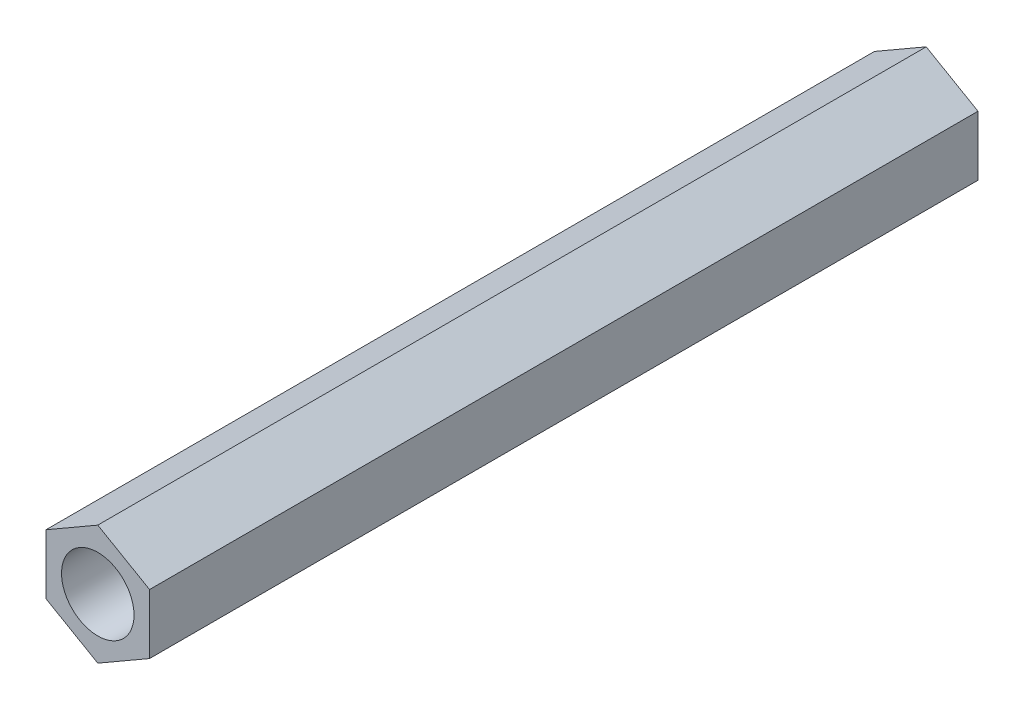
from build123d import *

# Parameters (mm, degrees)
EXTRUDE_1_DEPTH          = 40
CUT_EXTRUDE_1_DEPTH      = 41.181878171
CUT_EXTRUDE_1_DEPTH_BACK = 41.181878171
SKETCH_2_R               = 1.75


with BuildPart() as part:
    # 草圖1 → 填料-伸長1 (new body)
    with BuildSketch(Plane.XY):
        Polygon((0, -2.886751346), (2.5, -1.443375673), (2.5, 1.443375673), (0, 2.886751346), (-2.5, 1.443375673), (-2.5, -1.443375673), align=None)
    extrude(amount=EXTRUDE_1_DEPTH)

    # 草圖2 → 除料-伸長1 (cut, two sides: drawn at the far end of the back side and taken through both)
    with BuildSketch(Plane.XY.offset(40).offset(-CUT_EXTRUDE_1_DEPTH_BACK)):
        Circle(SKETCH_2_R)
    extrude(amount=CUT_EXTRUDE_1_DEPTH + CUT_EXTRUDE_1_DEPTH_BACK, mode=Mode.SUBTRACT)


solid = part.part
